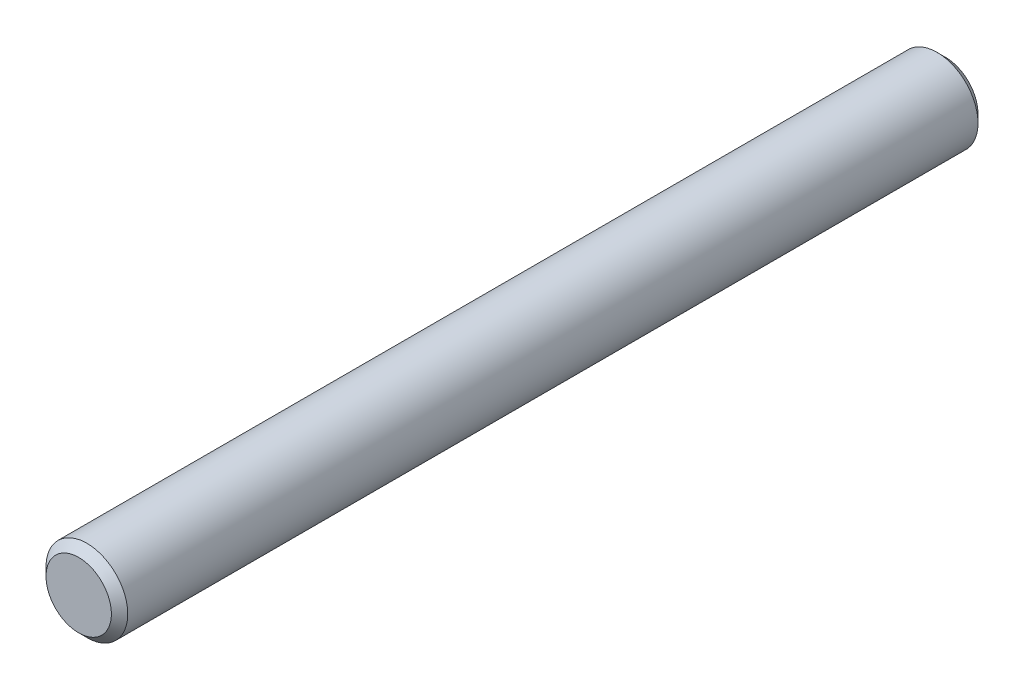
from build123d import *

# Parameters (mm, degrees)
EXTRUDE_1_DEPTH      = 10
EXTRUDE_1_DEPTH_BACK = 1
SKETCH_1_R           = 0.5
CHAMFER_1_SIZE       = 0.1
SKETCH_3_R           = 0.5
CUT_EXTRUDE_1_DEPTH  = 0.4
CHAMFER_2_SIZE       = 0.1


with BuildPart() as part:
    # 草图1 → 凸台-拉伸1 (new, two sides: drawn at the far end of the back side and taken through both)
    with BuildSketch(Plane.XY.offset(-EXTRUDE_1_DEPTH_BACK)):
        Circle(SKETCH_1_R)
    extrude(amount=EXTRUDE_1_DEPTH + EXTRUDE_1_DEPTH_BACK)

    # 倒角1
    chamfer_1_edges = [part.edges().sort_by_distance(p)[0] for p in [
        (-0.5, 0, -1),
        (-0.5, 0, 10),
    ]]
    chamfer(chamfer_1_edges, length=CHAMFER_1_SIZE)

    # 草图3 → 切除-拉伸1 (cut)
    with BuildSketch(Plane(origin=(0, 0, -1), x_dir=(-1, 0, 0), z_dir=(0, 0, -1))):
        with Locations(Location((0, 0, 0), (0, 0, 180))):
            Circle(SKETCH_3_R)
    extrude(amount=-CUT_EXTRUDE_1_DEPTH, mode=Mode.SUBTRACT)

    # 倒角2
    chamfer_2_edges = [part.edges().sort_by_distance(p)[0] for p in [
        (-0.5, 0, -0.6),
    ]]
    chamfer(chamfer_2_edges, length=CHAMFER_2_SIZE)


solid = part.part
